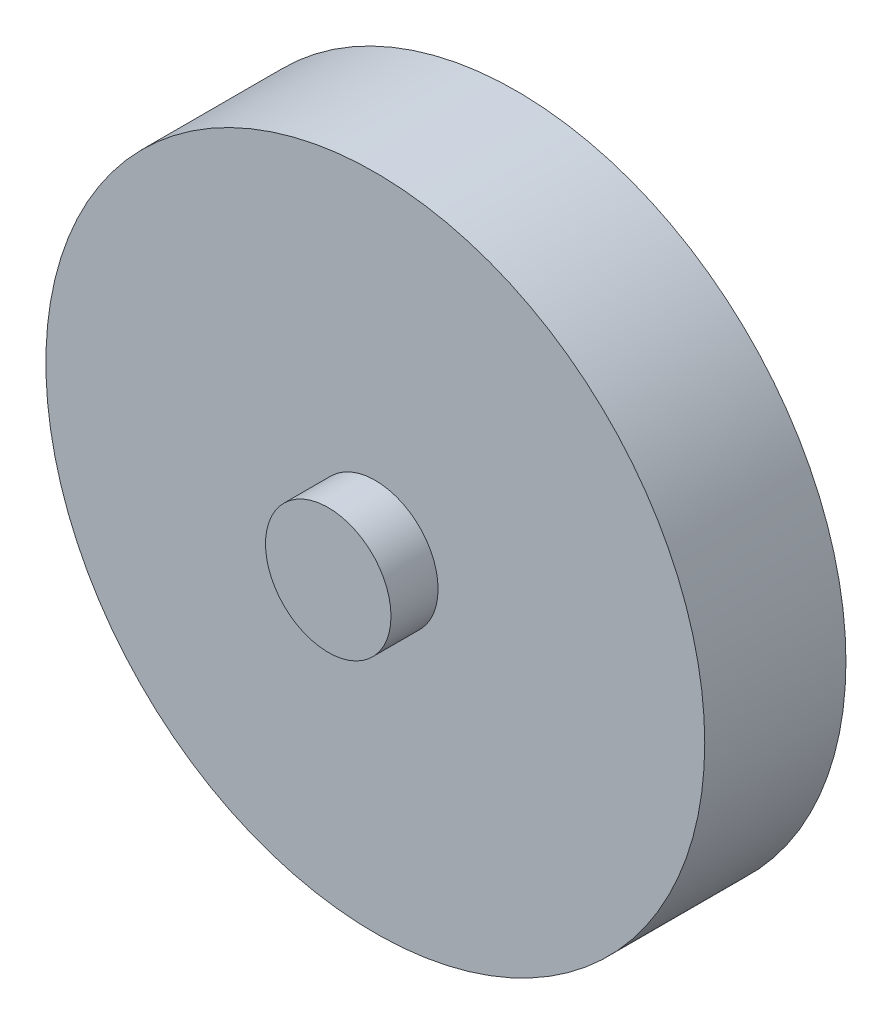
from build123d import *

# Parameters (mm, degrees)
SKETCH_1_R      = 8
EXTRUDE_1_DEPTH = 24
SKETCH_2_R      = 42
EXTRUDE_2_DEPTH = 18


with BuildPart() as part:
    # 草图1 → 凸台-拉伸1 (new body)
    with BuildSketch(Plane.XY):
        Circle(SKETCH_1_R)
    extrude(amount=EXTRUDE_1_DEPTH)

    # 草图2 → 凸台-拉伸2 (add)
    with BuildSketch(Plane.XY):
        Circle(SKETCH_2_R)
    extrude(amount=EXTRUDE_2_DEPTH)


solid = part.part
